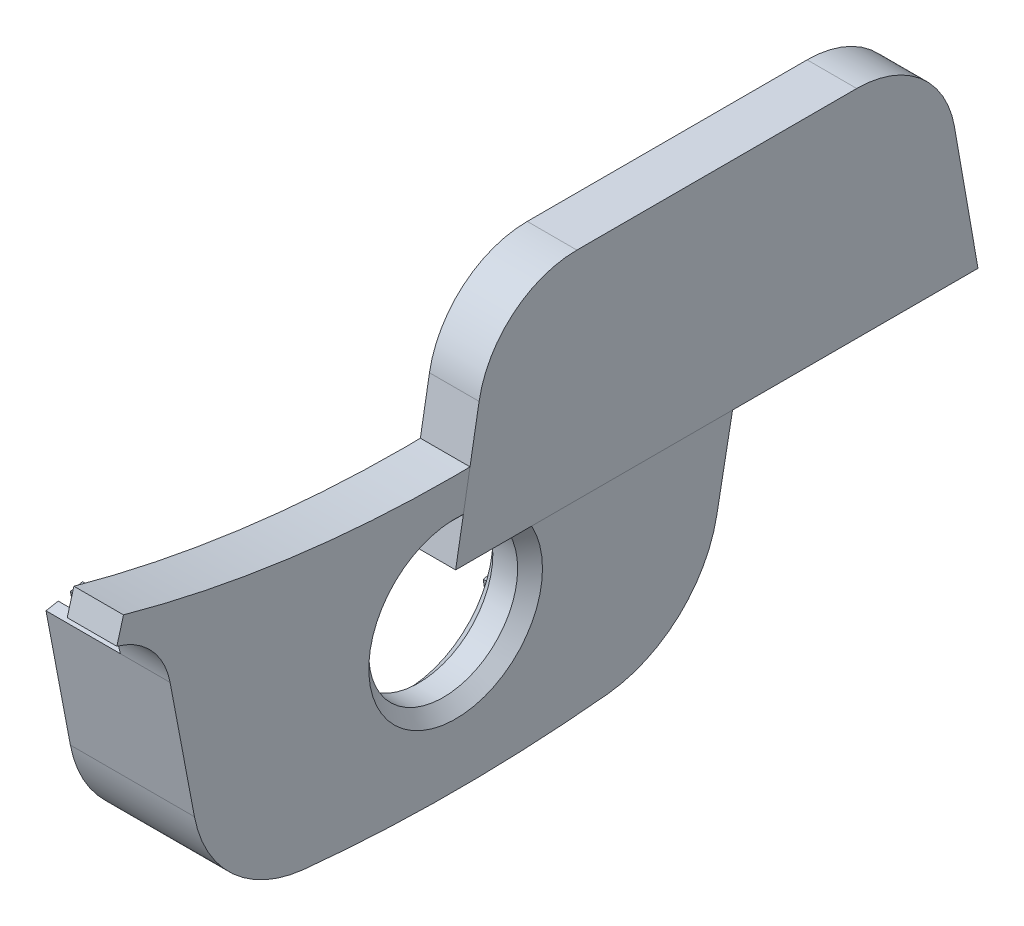
from build123d import *

# Parameters (mm, degrees)
EXTRUDE_1_DEPTH     = 2
EXTRUDE_2_DEPTH     = 2
EXTRUDE_5_DEPTH     = 5
SKETCH_7_R          = 3
CUT_EXTRUDE_1_DEPTH = 10
CHAMFER_3_SIZE      = 0.5


with BuildPart() as part:
    # Эскиз2 → Бобышка-Вытянуть1 (new body)
    with BuildSketch(Plane(origin=(0, 0, 0), x_dir=(0, 0, -1), z_dir=(1, 0, 0))):
        with BuildLine():
            Line((0, 0), (21.05, 0))
            Line((21.05, 0), (20.104030802, 5.409082892))
            ThreePointArc((20.104030802, 5.409082892), (18.737124717, 7.782379105), (16.163832232, 8.72))
            Line((16.163832232, 8.72), (4.886167768, 8.72))
            ThreePointArc((4.886167768, 8.72), (2.312875283, 7.782379105), (0.945969198, 5.409082892))
            Line((0.945969198, 5.409082892), (0, 0))
        make_face()
    extrude(amount=EXTRUDE_1_DEPTH)


with BuildPart() as body_2:
    # Эскиз3 → Бобышка-Вытянуть2 (new body)
    with BuildSketch(Plane(origin=(0, 0, 0), x_dir=(0, 0, -1), z_dir=(1, 0, 0))):
        with BuildLine():
            Line((11.506614891, 1.82874673), (10.524445921, -3.35031187))
            ThreePointArc((10.524445921, -3.35031187), (8.990381393, -6.104698232), (6.113073378, -7.393533672))
            ThreePointArc((6.113073378, -7.393533672), (0, -7.700615354), (-6.113073378, -7.393533672))
            ThreePointArc((-6.113073378, -7.393533672), (-8.990381393, -6.104698232), (-10.524445921, -3.35031187))
            Line((-10.524445921, -3.35031187), (-11.506614891, 1.82874673))
            ThreePointArc((-11.506614891, 1.82874673), (-12.24601398, 3.30065353), (-13.651076849, 4.160315659))
            Line((-13.651076849, 4.160315659), (-13.383408675, 5.123826815))
            ThreePointArc((-13.383408675, 5.123826815), (0, 3.299384646), (13.383408675, 5.123826815))
            Line((13.383408675, 5.123826815), (13.651076849, 4.160315659))
            ThreePointArc((13.651076849, 4.160315659), (12.24601398, 3.30065353), (11.506614891, 1.82874673))
        make_face()
    extrude(amount=EXTRUDE_2_DEPTH)

    # Эскиз4 → Бобышка-Вытянуть5 (add)
    with BuildSketch(Plane(origin=(2, 0, 0), x_dir=(0, 0, -1), z_dir=(1, 0, 0))):
        with BuildLine():
            Line((-10.033201508, -3.257151114), (-11.015370478, 1.921907487))
            Line((-11.015370478, 1.921907487), (-11.506614891, 1.82874673))
            Line((-11.506614891, 1.82874673), (-10.524445921, -3.35031187))
            ThreePointArc((-10.524445921, -3.35031187), (-9.069338414, -6.030742987), (-6.327818345, -7.367199695))
            Line((-6.327818345, -7.367199695), (-6.256236689, -6.872350156))
            ThreePointArc((-6.256236689, -6.872350156), (-8.723604752, -5.669539118), (-10.033201508, -3.257151114))
        make_face()
        with BuildLine():
            Line((-10.524126065, 2.015068244), (-9.541957094, -3.163990357))
            ThreePointArc((-9.541957094, -3.163990357), (-8.377871089, -5.30833525), (-6.184655034, -6.377500616))
            Line((-6.184655034, -6.377500616), (-6.113073378, -5.882651077))
            ThreePointArc((-6.113073378, -5.882651077), (-8.032137427, -4.947131381), (-9.050712681, -3.0708296))
            Line((-9.050712681, -3.0708296), (-10.032881652, 2.108229001))
            Line((-10.032881652, 2.108229001), (-10.524126065, 2.015068244))
        make_face()
    extrude_5 = extrude(amount=-EXTRUDE_5_DEPTH)

    # Зеркальное отражение1: Бобышка-Вытянуть5 across plane
    add(extrude_5.mirror(Plane.XY))

    # Эскиз7 → Вырез-Вытянуть1 (cut)
    with BuildSketch(Plane.ZY):
        with Locations((0, -1.700615354)):
            Circle(SKETCH_7_R)
    extrude(amount=-CUT_EXTRUDE_1_DEPTH, mode=Mode.SUBTRACT)

    # Фаска3
    chamfer_3_edges = [body_2.edges().sort_by_distance(p)[0] for p in [
        (2, -1.700615354, -3),
        (0, -1.700615354, -3),
    ]]
    chamfer(chamfer_3_edges, length=CHAMFER_3_SIZE)


solid = Compound([part.part, body_2.part])
